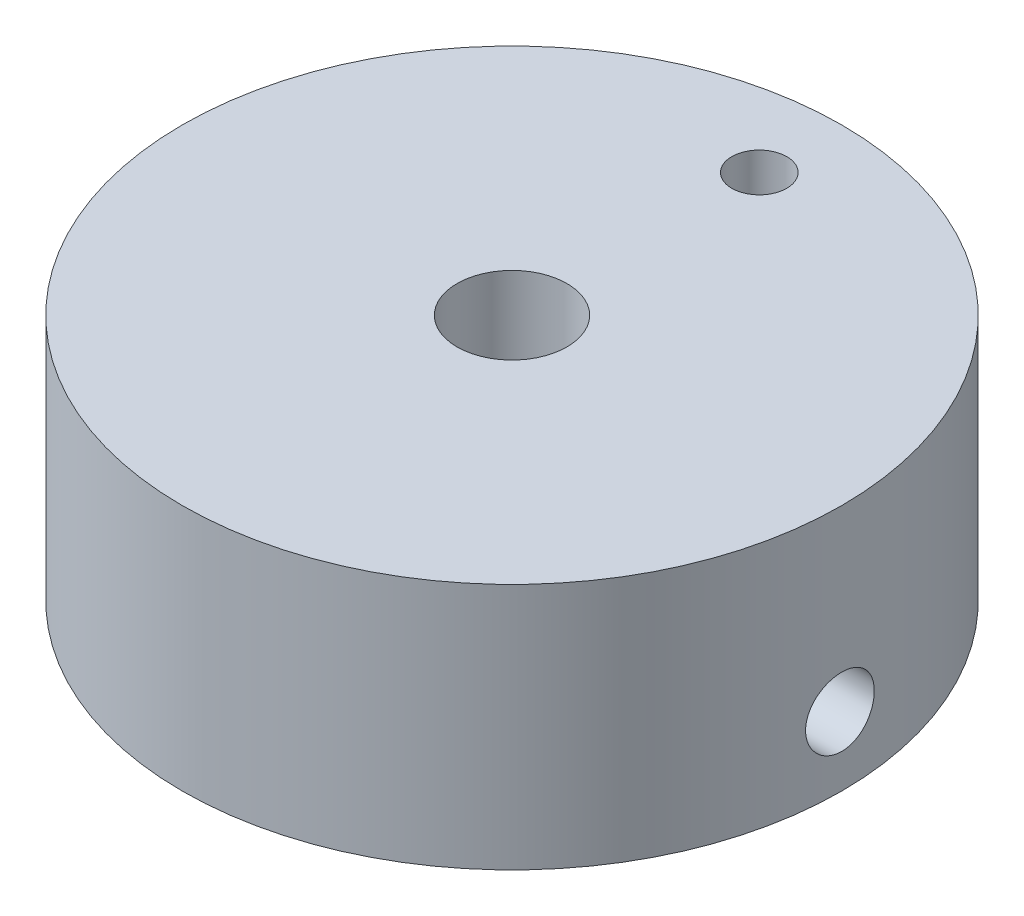
from build123d import *

# Parameters (mm, degrees)
SKETCH_1_R          = 12
EXTRUDE_1_DEPTH     = 9
SKETCH_2_R          = 2
CUT_EXTRUDE_1_DEPTH = 20.209372712
SKETCH_3_R          = 1
CUT_EXTRUDE_2_DEPTH = 3
SKETCH_4_R          = 1.25
CUT_EXTRUDE_3_DEPTH = 13
SKETCH_5_R          = 7.5
SKETCH_5_R_2        = 3.5
CUT_EXTRUDE_4_DEPTH = 0.3


with BuildPart() as part:
    # 草图1 → 凸台-拉伸1 (new body)
    with BuildSketch(Plane(origin=(0, 0, 0), x_dir=(1, 0, 0), z_dir=(0, 1, 0))):
        with Locations(Location((0, 0, 0), (0, 0, 270))):
            Circle(SKETCH_1_R)
    extrude(amount=EXTRUDE_1_DEPTH)

    # 草图2 → 切除-拉伸1 (cut, through all)
    with BuildSketch(Plane(origin=(0, 9, 0), x_dir=(1, 0, 0), z_dir=(0, 1, 0))):
        with Locations(Location((0, 0, 0), (0, 0, 270))):
            Circle(SKETCH_2_R)
    extrude(amount=-CUT_EXTRUDE_1_DEPTH, mode=Mode.SUBTRACT)

    # 草图3 → 切除-拉伸2 (cut)
    with BuildSketch(Plane(origin=(0, 9, 0), x_dir=(1, 0, 0), z_dir=(0, 1, 0))):
        with Locations(Location((0, 9, 0), (0, 0, 270))):
            Circle(SKETCH_3_R)
    extrude(amount=-CUT_EXTRUDE_2_DEPTH, mode=Mode.SUBTRACT)

    # 草图4 → 切除-拉伸3 (cut)
    with BuildSketch(Plane(origin=(0, 0, 0), x_dir=(0, 0, -1), z_dir=(1, 0, 0))):
        with Locations(Location((0, 2.5, 0), (0, 0, 180))):
            Circle(SKETCH_4_R)
    extrude(amount=CUT_EXTRUDE_3_DEPTH, mode=Mode.SUBTRACT)

    # 草图5 → 切除-拉伸4 (cut)
    with BuildSketch(Plane.XZ):
        with Locations(Location((0, 0, 0), (0, 0, 270))):
            Circle(SKETCH_5_R)
        with Locations(Location((0, 0, 0), (0, 0, 270))):
            Circle(SKETCH_5_R_2, mode=Mode.SUBTRACT)
    extrude(amount=-CUT_EXTRUDE_4_DEPTH, mode=Mode.SUBTRACT)


solid = part.part
